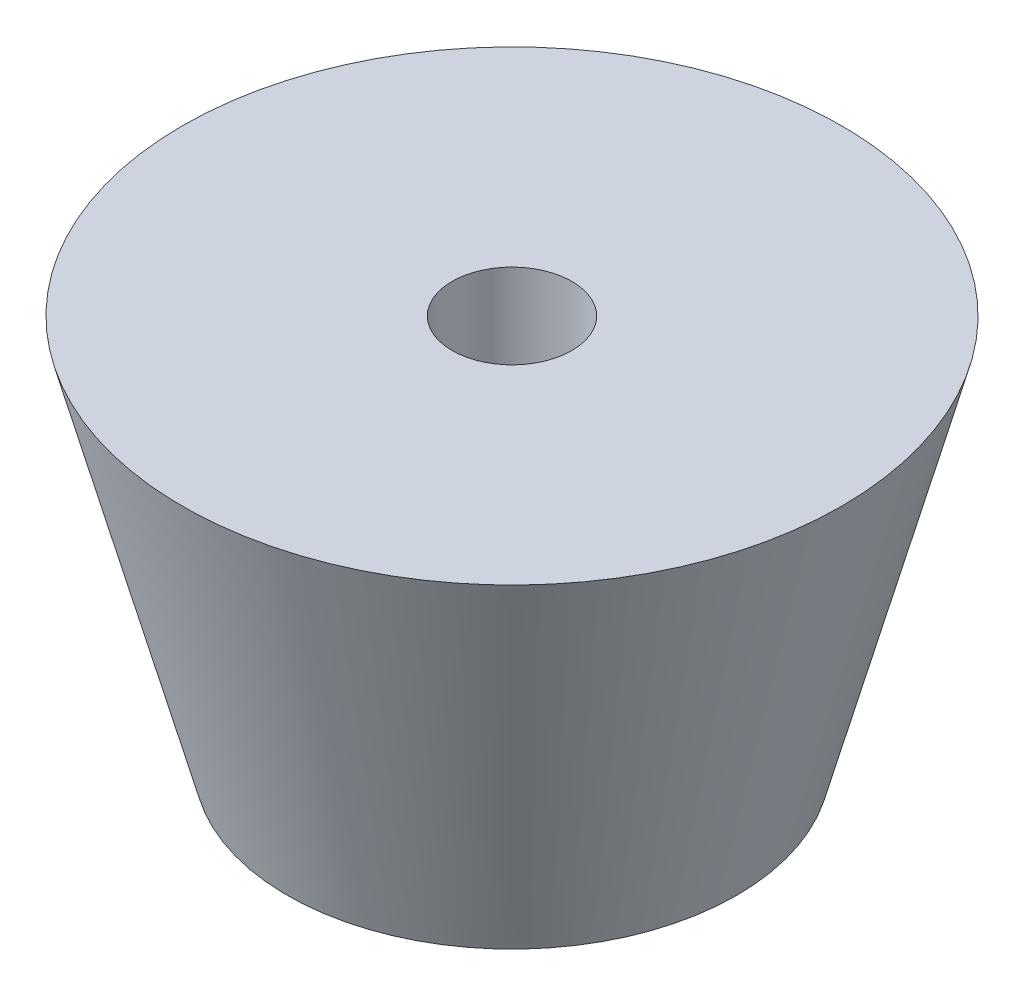
from build123d import *


with BuildPart() as part:
    # 草图1 → 旋转1 (revolve)
    with BuildSketch(Plane.XY, mode=Mode.PRIVATE) as revolve_1_sk:
        Polygon((-11, 0), (-2, 0), (-2, -6), (-4, -6), (-4, -13), (-7.5, -13), align=None)
    revolve(revolve_1_sk.sketch.rotate(Axis((0, -1000, 0), (0, 1, 0)), 180), axis=Axis((0, -1000, 0), (0, 1, 0)))


solid = part.part
